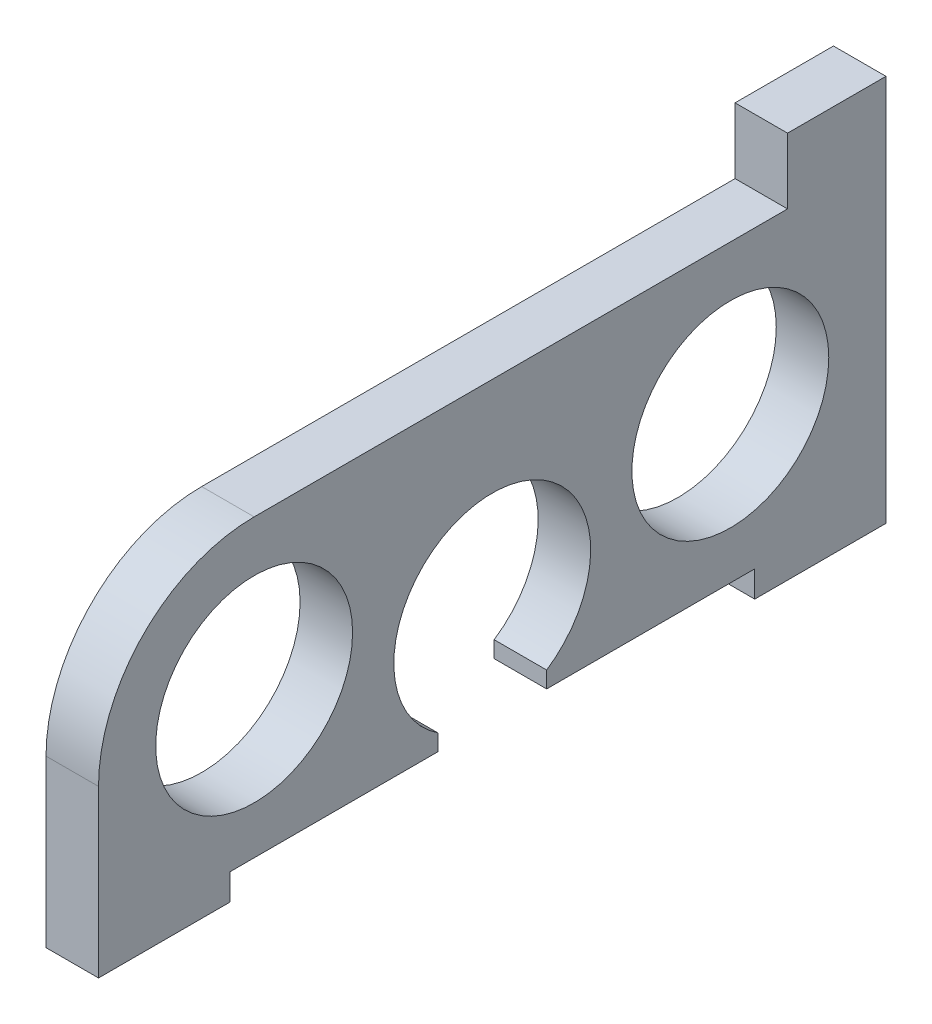
from build123d import *

# Parameters (mm, degrees)
SKETCH_2_R      = 3
EXTRUDE_1_DEPTH = 1.6


with BuildPart() as part:
    # 스케치2 → 보스-돌출1 (new body)
    with BuildSketch(Plane(origin=(0, 0, 0), x_dir=(0, 0, -1), z_dir=(1, 0, 0))):
        with BuildLine():
            Line((12, 1), (8, 1))
            Line((8, 1), (8, 1.8))
            Line((8, 1.8), (1.658312395, 1.8))
            Line((1.658312395, 1.8), (1.658312395, 2.3))
            ThreePointArc((1.658312395, 2.3), (0, 7.8), (-1.658312395, 2.3))
            Line((-1.658312395, 2.3), (-1.658312395, 1.8))
            Line((-1.658312395, 1.8), (-8, 1.8))
            Line((-8, 1.8), (-8, 1))
            Line((-8, 1), (-12, 1))
            Line((-12, 1), (-12, 6.056548766))
            ThreePointArc((-12, 6.056548766), (-10.6106753, 9.4106753), (-7.256548766, 10.8))
            Line((-7.256548766, 10.8), (9, 10.8))
            Line((9, 10.8), (9, 12.8))
            Line((9, 12.8), (12, 12.8))
            Line((12, 12.8), (12, 1))
        make_face()
        with Locations((-7.256548766, 6.25)):
            Circle(SKETCH_2_R, mode=Mode.SUBTRACT)
        with Locations((7.256548766, 6.25)):
            Circle(SKETCH_2_R, mode=Mode.SUBTRACT)
    extrude(amount=EXTRUDE_1_DEPTH)


solid = part.part
